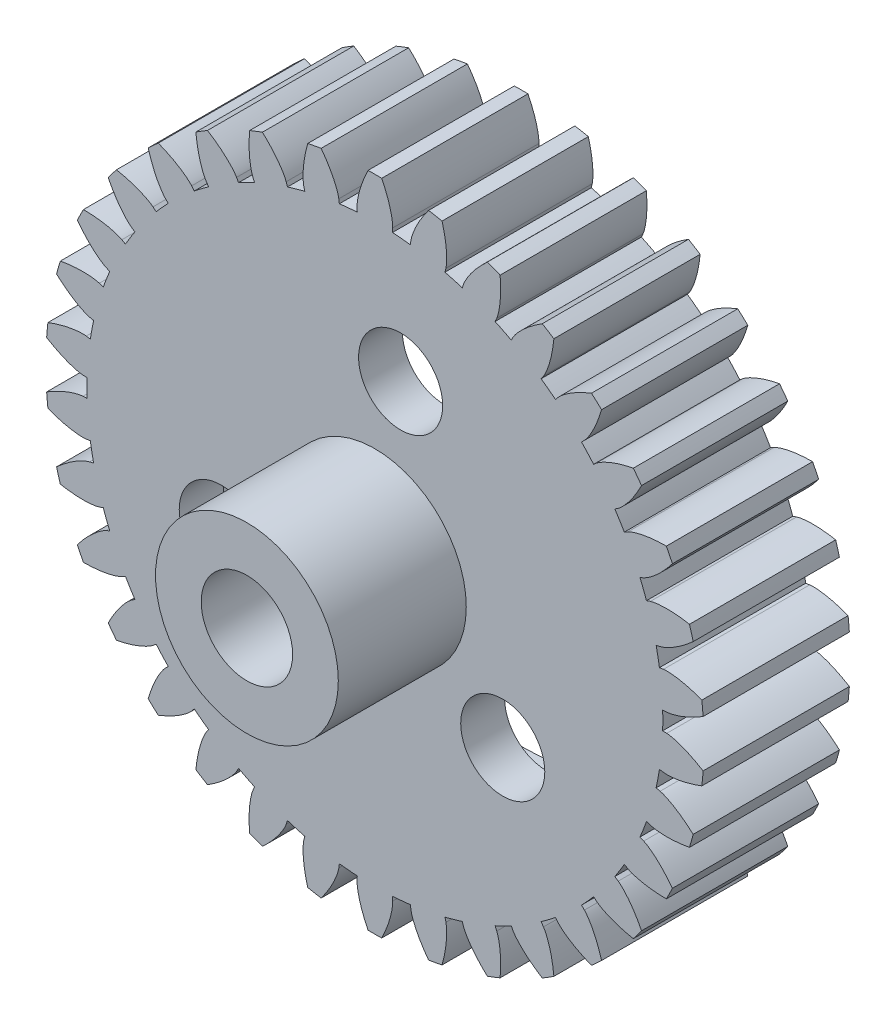
from build123d import *

# Parameters (mm, degrees)
SZKIC1_R                    = 18
DODANIE_WYCI_GNI_CIE1_DEPTH = 8
SZKIC2_R                    = 5
DODANIE_WYCI_GNI_CIE2_DEPTH = 7
SZKIC3_R                    = 2.5
WYTNIJ_WYCI_GNI_CIE1_DEPTH  = 30.546573405
WYTNIJ_WYCI_GNI_CIE3_DEPTH  = 30.546573405
SZYK_KO_OWY2_COUNT          = 34
SZKIC5_R                    = 2.3
WYTNIJ_WYCI_GNI_CIE4_DEPTH  = 30.518484561
SZKIC6_R                    = 13.1
WYTNIJ_WYCI_GNI_CIE5_DEPTH  = 5.6


with BuildPart() as part:
    # Szkic1 → Dodanie-wyciągnięcie1 (new body)
    with BuildSketch(Plane.XY):
        Circle(SZKIC1_R)
    extrude(amount=DODANIE_WYCI_GNI_CIE1_DEPTH)

    # Szkic2 → Dodanie-wyciągnięcie2 (add)
    with BuildSketch(Plane.XY.offset(8)):
        Circle(SZKIC2_R)
    extrude(amount=DODANIE_WYCI_GNI_CIE2_DEPTH)

    # Szkic3 → Wytnij-wyciągnięcie1 (cut, through all)
    with BuildSketch(Plane.XY.offset(15)):
        Circle(SZKIC3_R)
    extrude(amount=-WYTNIJ_WYCI_GNI_CIE1_DEPTH, mode=Mode.SUBTRACT)

    # Szkic4 → Wytnij-wyciągnięcie3 (cut, through all)
    with BuildSketch(Plane(origin=(0, 0, 0), x_dir=(-1, 0, 0), z_dir=(0, 0, -1))):
        with BuildLine():
            add(Edge.make_bspline(
                [(15.966952274, 0.499857083), (15.973588962, 0.500170319), (15.992186505, 0.50137492), (16.02727088, 0.504939353), (16.084356841, 0.51257942), (16.156811425, 0.524989314), (16.250055561, 0.544090693), (16.35930311, 0.570516104), (16.478642956, 0.603649308), (16.607603741, 0.644089594), (16.735410352, 0.688300579), (16.862041069, 0.735980193), (16.98736125, 0.78669031), (17.138115077, 0.851887366), (17.31737635, 0.935292978), (17.524511841, 1.040318379), (17.71815035, 1.147138444), (17.855509236, 1.228083556), (17.933604649, 1.275621993), (17.953855397, 1.288051396)],
                knots=[0, 0, 0, 0, 0, 0.005376749, 0.015083688, 0.02853182, 0.046610139, 0.064854849, 0.092110525, 0.119476176, 0.146842496, 0.174208854, 0.201574956, 0.228941013, 0.256307345, 0.307035032, 0.361767352, 0.416499661, 0.435734814, 0.435734814, 0.435734814, 0.435734814, 0.435734814], degree=4))
            Line((15.966952274, 0.499857083), (15.742287785, 0.492823797))
            ThreePointArc((15.742287785, 0.492823797), (15.75, 0), (15.742287785, -0.492823797))
            Line((15.742287785, -0.492823797), (15.966952274, -0.499857083))
            add(Edge.make_bspline(
                [(15.966952274, -0.499857083), (15.973588962, -0.500170319), (15.992186505, -0.50137492), (16.02727088, -0.504939353), (16.084356841, -0.51257942), (16.156811425, -0.524989314), (16.250055561, -0.544090693), (16.35930311, -0.570516104), (16.478642956, -0.603649308), (16.607603741, -0.644089594), (16.735410352, -0.688300579), (16.862041069, -0.735980193), (16.98736125, -0.78669031), (17.138115077, -0.851887366), (17.31737635, -0.935292978), (17.524511841, -1.040318379), (17.71815035, -1.147138444), (17.855509236, -1.228083556), (17.933604649, -1.275621993), (17.953855397, -1.288051396)],
                knots=[0, 0, 0, 0, 0, 0.005376749, 0.015083688, 0.02853182, 0.046610139, 0.064854849, 0.092110525, 0.119476176, 0.146842496, 0.174208854, 0.201574956, 0.228941013, 0.256307345, 0.307035032, 0.361767352, 0.416499661, 0.435734814, 0.435734814, 0.435734814, 0.435734814, 0.435734814], degree=4))
            ThreePointArc((17.953855397, -1.288051396), (17.98846015, -0.644438849), (18, 0))
            ThreePointArc((18, 0), (17.98846015, 0.644438849), (17.953855397, 1.288051396))
        make_face()
        with BuildLine():
            ThreePointArc((17.411478068, -4.565132145), (17.693515794, -3.307491321), (17.884835713, -2.032892399))
            add(Edge.make_bspline(
                [(15.786933067, -2.442573715), (15.79351431, -2.443485301), (15.812016539, -2.4457185), (15.847158499, -2.448661495), (15.904676322, -2.451641033), (15.978177541, -2.452755935), (16.073343888, -2.451113359), (16.185586946, -2.445212075), (16.308983015, -2.434571666), (16.44317888, -2.418516435), (16.576933087, -2.398542629), (16.710168782, -2.374943184), (16.842673108, -2.348124026), (17.002839993, -2.311738017), (17.194374743, -2.262691716), (17.417281726, -2.197515619), (17.627251306, -2.128095352), (17.777145022, -2.073768113), (17.862645876, -2.041389102), (17.884835713, -2.032892399)],
                knots=[0, 0, 0, 0, 0, 0.005376749, 0.015083688, 0.02853182, 0.046610139, 0.064854849, 0.092110525, 0.119476176, 0.146842496, 0.174208854, 0.201574956, 0.228941013, 0.256307345, 0.307035032, 0.361767352, 0.416499661, 0.435734814, 0.435734814, 0.435734814, 0.435734814, 0.435734814], degree=4))
            Line((15.786933067, -2.442573715), (15.564801555, -2.408205254))
            ThreePointArc((15.564801555, -2.408205254), (15.48182632, -2.894054906), (15.383689285, -3.377070325))
            Line((15.383689285, -3.377070325), (15.603236072, -3.425265848))
            add(Edge.make_bspline(
                [(15.603236072, -3.425265848), (15.6097022, -3.426793239), (15.62776174, -3.431394618), (15.661593774, -3.441345097), (15.716303879, -3.459344595), (15.785244474, -3.484856683), (15.873391083, -3.520766389), (15.975922828, -3.566816041), (16.087142476, -3.621313729), (16.206476576, -3.684761925), (16.323983288, -3.751704536), (16.439696771, -3.821840647), (16.553565178, -3.894714851), (16.689772207, -3.986502747), (16.850655475, -4.101427392), (17.034965725, -4.242725582), (17.205679034, -4.383307815), (17.325825499, -4.488114312), (17.393856024, -4.549193312), (17.411478068, -4.565132145)],
                knots=[0, 0, 0, 0, 0, 0.005376749, 0.015083688, 0.02853182, 0.046610139, 0.064854849, 0.092110525, 0.119476176, 0.146842496, 0.174208854, 0.201574956, 0.228941013, 0.256307345, 0.307035032, 0.361767352, 0.416499661, 0.435734814, 0.435734814, 0.435734814, 0.435734814, 0.435734814], degree=4))
        make_face()
    wytnij_wyci_gni_cie3 = extrude(amount=-WYTNIJ_WYCI_GNI_CIE3_DEPTH, mode=Mode.SUBTRACT)

    # Szyk kołowy2: Wytnij-wyciągnięcie3 ×34 about axis
    szyk_ko_owy2_axis = Axis((0, 0, 0), (0, 0, 1))
    for i in range(1, SZYK_KO_OWY2_COUNT):
        add(wytnij_wyci_gni_cie3.rotate(szyk_ko_owy2_axis, i * 360 / SZYK_KO_OWY2_COUNT), mode=Mode.SUBTRACT)

    # Szkic5 → Wytnij-wyciągnięcie4 (cut, through all)
    with BuildSketch(Plane(origin=(0, 0, 0), x_dir=(-1, 0, 0), z_dir=(0, 0, -1))):
        with Locations((-1.407910185, 8.889195065)):
            Circle(SZKIC5_R)
        with Locations((8.402223838, -3.225311546)):
            Circle(SZKIC5_R)
        with Locations((-6.994313653, -5.663883519)):
            Circle(SZKIC5_R)
    extrude(amount=-WYTNIJ_WYCI_GNI_CIE4_DEPTH, mode=Mode.SUBTRACT)

    # Szkic6 → Wytnij-wyciągnięcie5 (cut)
    with BuildSketch(Plane(origin=(0, 0, 0), x_dir=(-1, 0, 0), z_dir=(0, 0, -1))):
        Circle(SZKIC6_R)
    extrude(amount=-WYTNIJ_WYCI_GNI_CIE5_DEPTH, mode=Mode.SUBTRACT)


solid = part.part
